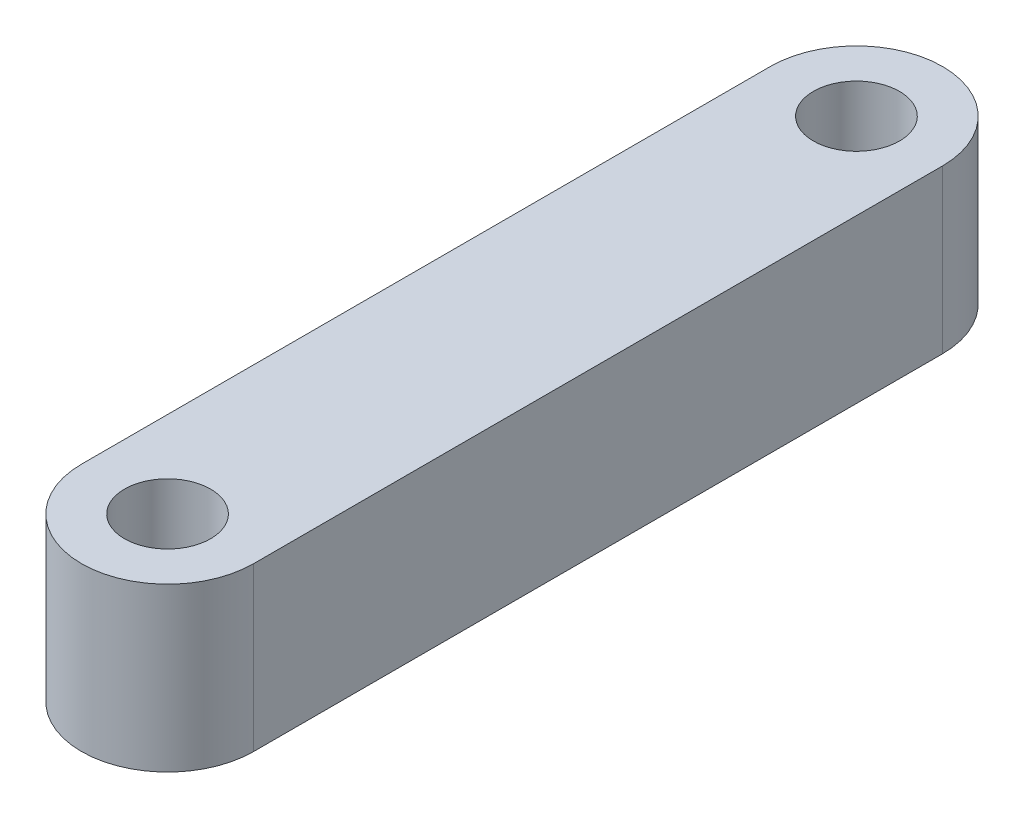
from build123d import *

# Parameters (mm, degrees)
SKETCH1_R           = 1.5875
BOSS_EXTRUDE1_DEPTH = 6


with BuildPart() as part:
    # Sketch1 → Boss-Extrude1 (new body)
    with BuildSketch(Plane(origin=(0, 0, 0), x_dir=(1, 0, 0), z_dir=(0, 1, 0))):
        with BuildLine():
            Line((-3.175, 25.399999799), (-3.175, 2.01e-07))
            ThreePointArc((-3.175, 2.01e-07), (0, -3.175), (3.175, 2.01e-07))
            Line((3.175, 2.01e-07), (3.175, 25.399999799))
            ThreePointArc((3.175, 25.399999799), (0, 28.575), (-3.175, 25.399999799))
        make_face()
        with Locations(Location((0, 0, 0), (0, 0, 270))):
            Circle(SKETCH1_R, mode=Mode.SUBTRACT)
        with Locations(Location((0, 25.4, 0), (0, 0, 270))):
            Circle(SKETCH1_R, mode=Mode.SUBTRACT)
    extrude(amount=BOSS_EXTRUDE1_DEPTH)


solid = part.part
